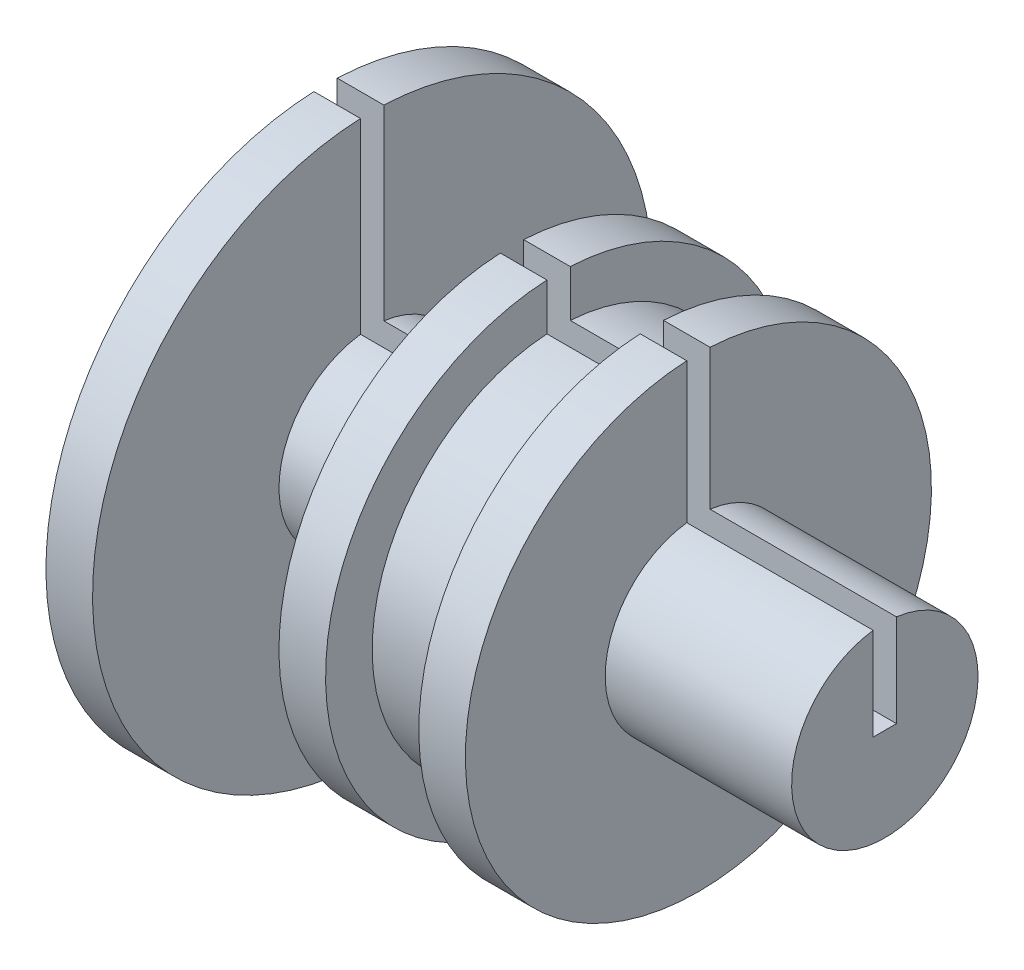
from build123d import *

# Parameters (mm, degrees)
SKETCH2_W          = 2.5
SKETCH2_H          = 34.957041577
CUT_EXTRUDE1_DEPTH = 74.484692283


with BuildPart() as part:
    # Sketch1 → Revolve1 (revolve)
    with BuildSketch(Plane.XY, mode=Mode.PRIVATE) as revolve1_sk:
        Polygon((20, 10), (5, 10), (5, 30), (0, 30), (0, 0), (60, 0), (60, 10), (40, 10), (40, 25), (35, 25), (35, 20), (25, 20), (25, 25), (20, 25), align=None)
    revolve(revolve1_sk.sketch.rotate(Axis((0, 0, 0), (1, 0, 0)), 90), axis=Axis((0, 0, 0), (1, 0, 0)))

    # Sketch2 → Cut-Extrude1 (cut, through all)
    with BuildSketch(Plane(origin=(60, 0, 0), x_dir=(0, 0, -1), z_dir=(1, 0, 0))):
        with Locations((0, 17.478520789)):
            Rectangle(SKETCH2_W, SKETCH2_H)
    extrude(amount=-CUT_EXTRUDE1_DEPTH, mode=Mode.SUBTRACT)


solid = part.part
